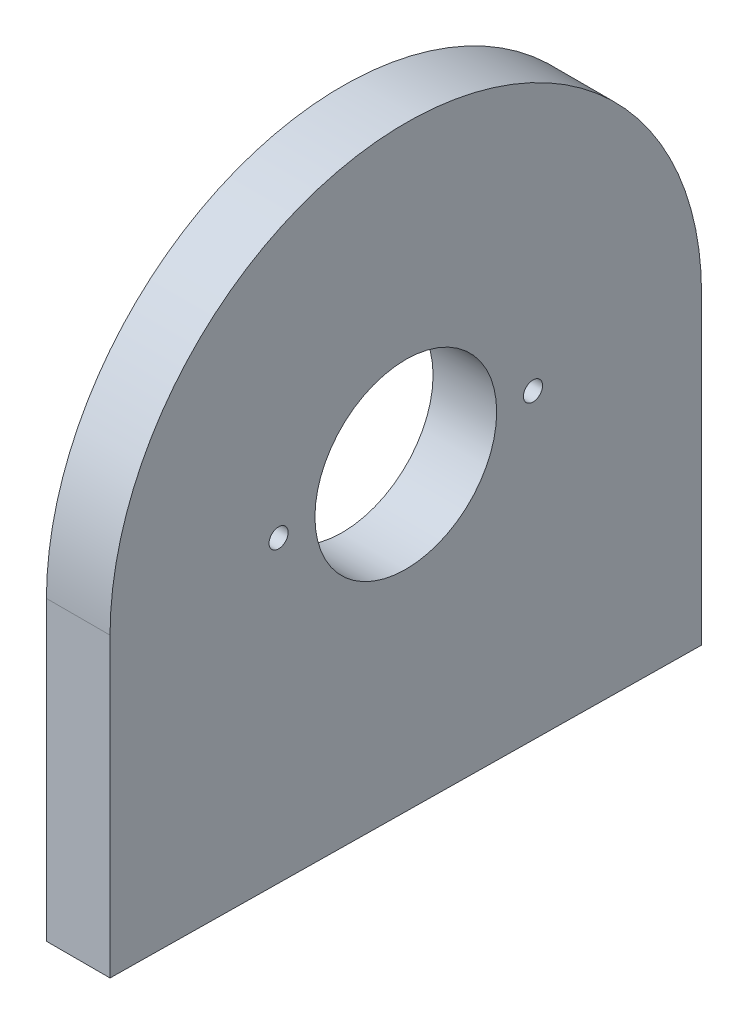
from build123d import *

# Parameters (mm, degrees)
SKETCH1_R           = 14.2875
SKETCH1_R_2         = 1.5
BOSS_EXTRUDE1_DEPTH = 10


with BuildPart() as part:
    # Sketch1 → Boss-Extrude1 (new body)
    with BuildSketch(Plane(origin=(0, 0, 0), x_dir=(0, 0, -1), z_dir=(1, 0, 0))):
        with BuildLine():
            Line((-46.5, 0), (-46.5, -46.680661448))
            Line((-46.5, -46.680661448), (46.5, -47.858478877))
            Line((46.5, -47.858478877), (46.5, 0))
            ThreePointArc((46.5, 0), (0, 46.5), (-46.5, 0))
        make_face()
        Circle(SKETCH1_R, mode=Mode.SUBTRACT)
        with Locations((20, 0)):
            Circle(SKETCH1_R_2, mode=Mode.SUBTRACT)
        with Locations((-20, 0)):
            Circle(SKETCH1_R_2, mode=Mode.SUBTRACT)
    extrude(amount=BOSS_EXTRUDE1_DEPTH)


solid = part.part
